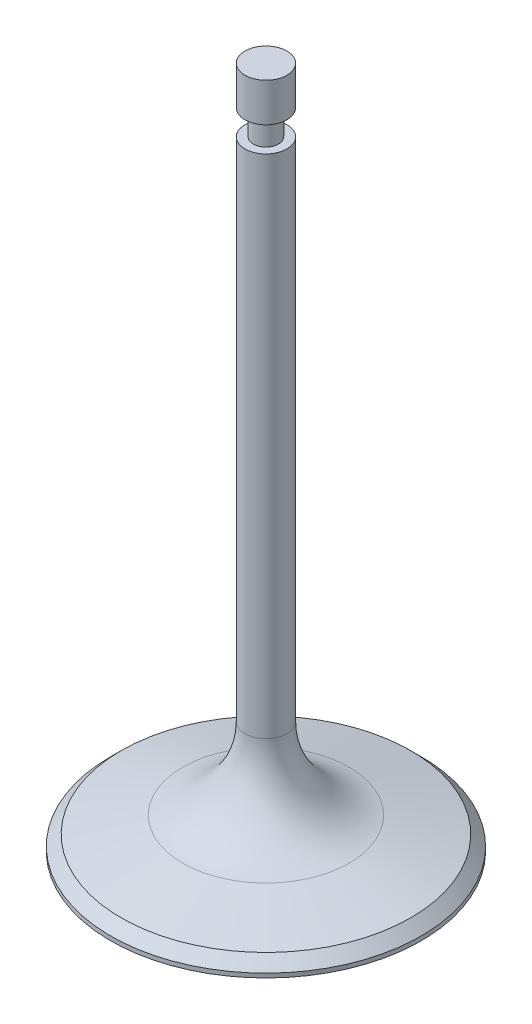
from build123d import *


with BuildPart() as part:
    # Sketch1 → Revolve1 (revolve)
    with BuildSketch(Plane.XY, mode=Mode.PRIVATE) as revolve1_sk:
        with BuildLine():
            Line((18.5, -0.5), (18.5, 0))
            Line((18.5, 0), (17.25, 1.25))
            Line((17.25, 1.25), (9.911809549, 3.216262205))
            ThreePointArc((9.911809549, 3.216262205), (4.566466597, 6.787906178), (2.5, 12.875520468))
            Line((2.5, 12.875520468), (2.5, 73.19))
            Line((2.5, 73.19), (1.5, 73.19))
            Line((1.5, 73.19), (1.5, 76.19))
            Line((1.5, 76.19), (2.5, 76.19))
            Line((2.5, 76.19), (2.5, 80.79))
            Line((2.5, 80.79), (0, 80.79))
            Line((0, 80.79), (0, -2))
            ThreePointArc((0, -2), (9.280355597, -1.624385692), (18.5, -0.5))
        make_face()
    revolve(revolve1_sk.sketch.rotate(Axis((0, 80.79, 0), (0, -1, 0)), 180), axis=Axis((0, 80.79, 0), (0, -1, 0)))


solid = part.part
